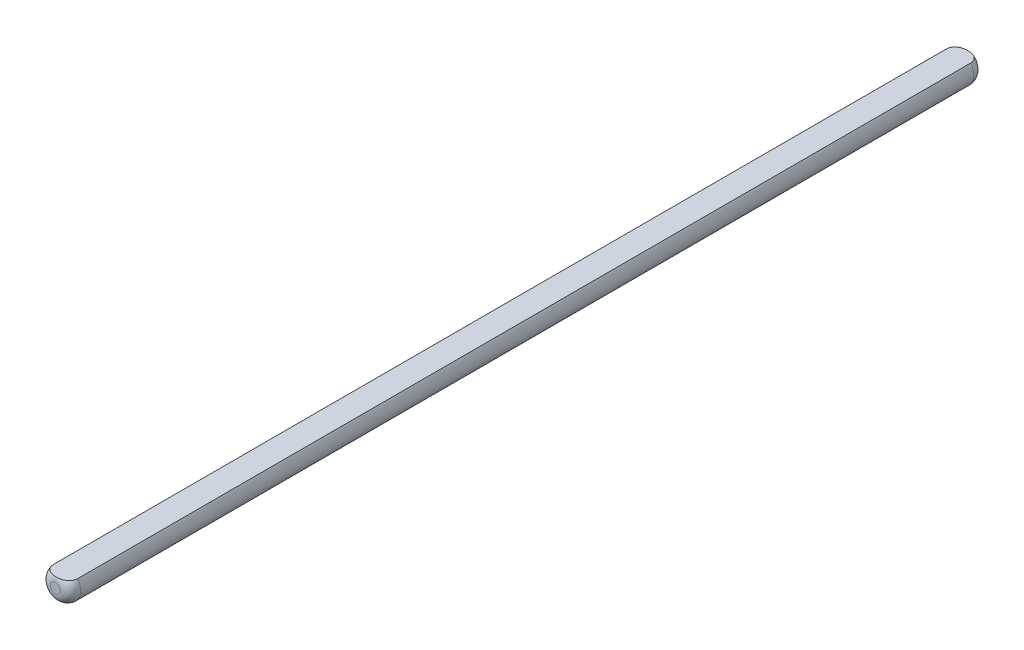
from build123d import *

# Parameters (mm, degrees)
ESQUISSE1_R             = 3
BOSS_EXTRU_1_DEPTH      = 180
CONG_1_R                = 2
ESQUISSE2_W             = 6
ESQUISSE2_H             = 1.2
ENL_V_MAT_EXTRU_1_DEPTH = 181.049993057


with BuildPart() as part:
    # Esquisse1 → Boss.-Extru.1 (new body)
    with BuildSketch(Plane.XY):
        with Locations(Location((0, 0, 0), (0, 0, 180))):
            Circle(ESQUISSE1_R)
    extrude(amount=BOSS_EXTRU_1_DEPTH)

    # Congé1
    cong_1_edges = [part.edges().sort_by_distance(p)[0] for p in [
        (3, 0, 0),
        (3, 0, 180),
    ]]
    fillet(cong_1_edges, radius=CONG_1_R)

    # Esquisse2 → Enlèv. mat.-Extru.1 (cut, through all)
    with BuildSketch(Plane.XY.offset(180)):
        with Locations((0, 2.4)):
            Rectangle(ESQUISSE2_W, ESQUISSE2_H)
    extrude(amount=-ENL_V_MAT_EXTRU_1_DEPTH, mode=Mode.SUBTRACT)


solid = part.part
